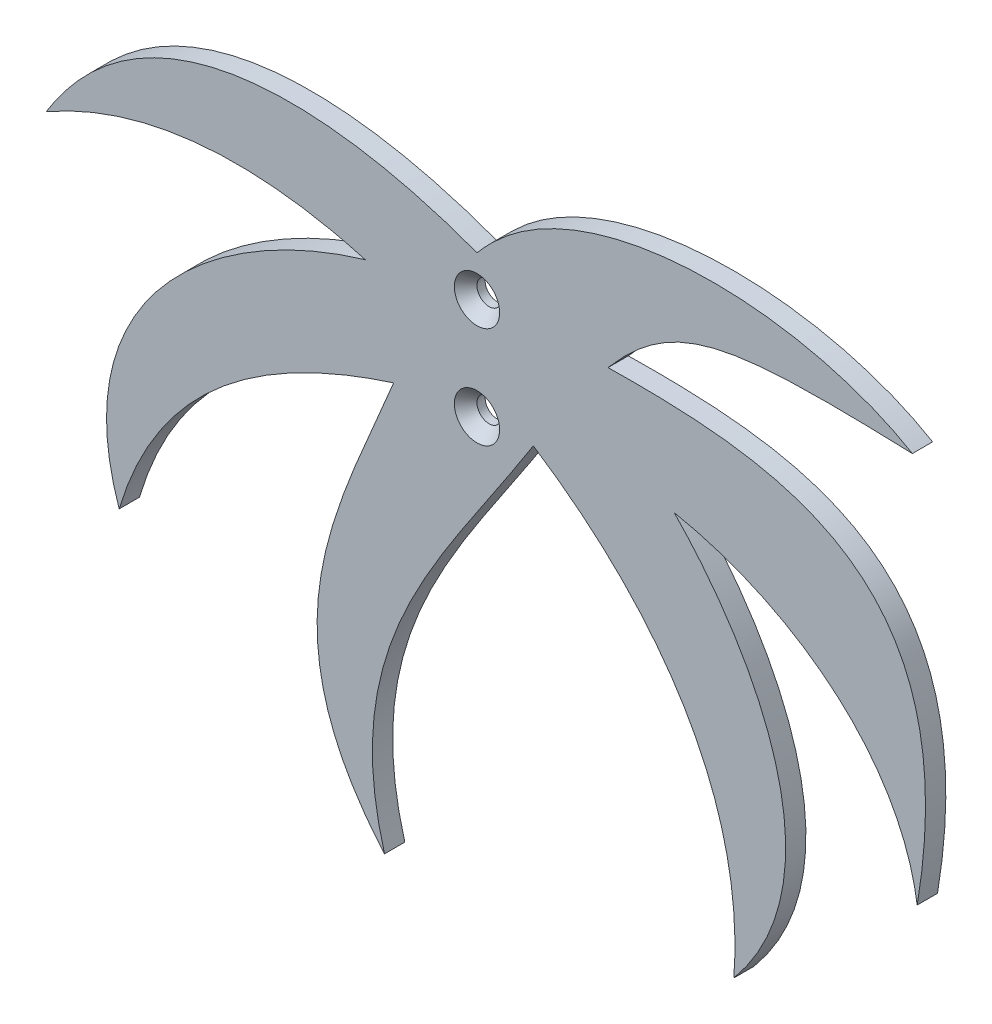
from build123d import *

# Parameters (mm, degrees)
BOSS_EXTRUDE1_DEPTH                           = 3.175
CSK_FOR_6_FLAT_HEAD_MACHINE_SCREW1_AT_2_COUNT = 2
CSK_FOR_6_FLAT_HEAD_MACHINE_SCREW1_AT_2_PITCH = 15.875


with BuildPart() as part:
    # Sketch1 → Boss-Extrude1 (new body)
    with BuildSketch(Plane.XY):
        with BuildLine():
            add(Edge.make_bspline(
                [(34.931884294, 165.025383652), (48.828055098, 187.719675837), (76.45444521, 188.520066825), (100.445839981, 180.332984416), (102.354778378, 179.613312562)],
                knots=[0, 0, 0, 0, 0.389677888, 0.423902211, 0.423902211, 0.423902211, 0.423902211], degree=3))
            add(Edge.make_bspline(
                [(102.354778378, 179.613312562), (103.688252769, 181.188793447), (120.08516999, 197.822043176), (153.725104458, 196.423627733), (170.491254722, 186.467930029)],
                knots=[0.566670892, 0.566670892, 0.566670892, 0.566670892, 0.604773786, 1, 1, 1, 1], degree=3))
            add(Edge.make_bspline(
                [(122.854505464, 174.304585318), (133.217704907, 186.42088718), (141.87402844, 187.437840711), (170.491254722, 186.467930029)],
                knots=[0.652055608, 0.652055608, 0.652055608, 0.652055608, 1, 1, 1, 1], degree=3))
            add(Edge.make_bspline(
                [(122.854505464, 174.304585318), (150.100917529, 174.691970084), (179.076532886, 172.111025689), (171.253334777, 125.653941669)],
                knots=[0.582619189, 0.582619189, 0.582619189, 0.582619189, 1, 1, 1, 1], degree=3))
            add(Edge.make_bspline(
                [(133.211242061, 159.831846766), (133.979472702, 159.682774194), (151.701954736, 155.882016517), (168.618692728, 143.562281616), (171.253334777, 125.653941669)],
                knots=[0.658818977, 0.658818977, 0.658818977, 0.658818977, 0.673582965, 1, 1, 1, 1], degree=3))
            add(Edge.make_bspline(
                [(133.211242061, 159.831846766), (135.171104002, 157.821803299), (149.411618041, 141.491919338), (156.677266996, 118.334043551), (142.542206677, 101.410441691)],
                knots=[0.632989669, 0.632989669, 0.632989669, 0.632989669, 0.680758972, 1, 1, 1, 1], degree=3))
            add(Edge.make_bspline(
                [(111.168977908, 157.851131594), (130.281346763, 145.416554664), (144.493361512, 126.332685465), (142.542206677, 101.410441691)],
                knots=[0.543056126, 0.543056126, 0.543056126, 0.543056126, 1, 1, 1, 1], degree=3))
            add(Edge.make_bspline(
                [(87.881776799, 90.903091177), (80.744106998, 115.729737526), (96.501549834, 135.001149116), (109.967437477, 155.985823694), (111.168977908, 157.851131594)],
                knots=[0, 0, 0, 0, 0.464688532, 0.510268863, 0.510268863, 0.510268863, 0.510268863], degree=3))
            add(Edge.make_bspline(
                [(87.881776799, 90.903091177), (69.284973328, 112.208882094), (79.686924952, 132.536670793), (88.858930138, 154.386086423), (89.308499289, 155.455602419)],
                knots=[0, 0, 0, 0, 0.384997093, 0.404814032, 0.404814032, 0.404814032, 0.404814032], degree=3))
            add(Edge.make_bspline(
                [(46.348413822, 116.89002104), (52.796354346, 138.61615839), (70.085133937, 149.298268287), (89.308499289, 155.455602419)],
                knots=[0, 0, 0, 0, 0.378547614, 0.378547614, 0.378547614, 0.378547614], degree=3))
            add(Edge.make_bspline(
                [(46.348413822, 116.89002104), (37.891933448, 141.39657653), (59.918576266, 161.597817566), (82.928148168, 169.350328204), (84.88315803, 169.928160001)],
                knots=[0, 0, 0, 0, 0.348685432, 0.380913319, 0.380913319, 0.380913319, 0.380913319], degree=3))
            add(Edge.make_bspline(
                [(34.931884294, 165.025383652), (50.935408962, 174.180938827), (68.379973418, 174.627254849), (84.88315803, 169.928160001)],
                knots=[0, 0, 0, 0, 0.348652947, 0.348652947, 0.348652947, 0.348652947], degree=3))
        make_face()
    extrude(amount=BOSS_EXTRUDE1_DEPTH)

    # Sketch3 → CSK for #6 Flat Head Machine Screw1 (revolve, cut)
    with BuildSketch(Plane(origin=(102.354778378, 173.263312562, 3.175), x_dir=(0, -1, 0), z_dir=(1, 0, 0))):
        Polygon((0, 0), (0, 3.175), (1.89865, 3.175), (1.89865, 1.891953401), (3.5433, 0), align=None)
    csk_for_6_flat_head_machine_screw1 = revolve(axis=Axis((102.354778378, 173.263312562, 9.525), (0, 0, -1)), mode=Mode.SUBTRACT)

    # CSK for #6 Flat Head Machine Screw1 at 2: CSK for #6 Flat Head Machine Screw1 ×2
    with Locations(*[(0, -i * CSK_FOR_6_FLAT_HEAD_MACHINE_SCREW1_AT_2_PITCH, 0) for i in range(1, CSK_FOR_6_FLAT_HEAD_MACHINE_SCREW1_AT_2_COUNT)]):
        add(csk_for_6_flat_head_machine_screw1, mode=Mode.SUBTRACT)


solid = part.part
